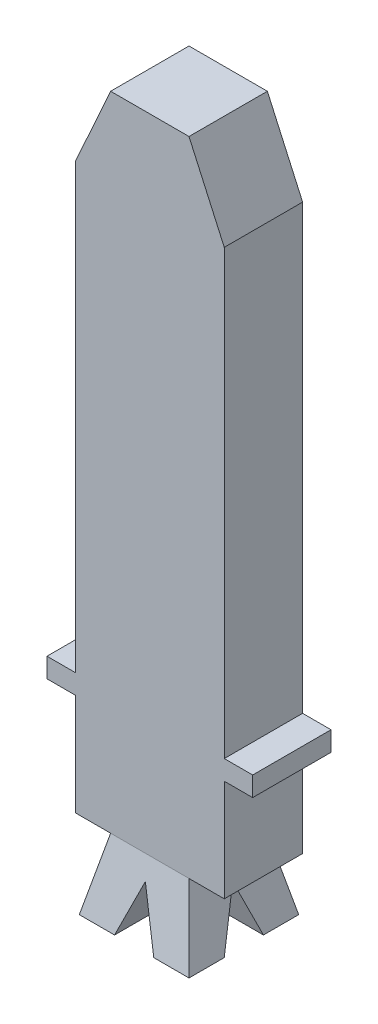
from build123d import *

# Parameters (mm, degrees)
BOSS_EXTRUDE1_DEPTH     = 2
CUT_EXTRUDE1_DEPTH      = 14.733922435
CUT_EXTRUDE1_DEPTH_BACK = 14.733922435
CUT_EXTRUDE2_DEPTH      = 15.632519463
CUT_EXTRUDE2_DEPTH_BACK = 15.632519463


with BuildPart() as part:
    # Sketch1 → Boss-Extrude1 (new body)
    with BuildSketch(Plane.XY):
        Polygon((1.9, 0), (2.625, 0), (2.625, -0.5), (1.9, -0.5), (1.9, -3.1), (-1.9, -3.1), (-1.9, -0.5), (-2.625, -0.5), (-2.625, 0), (-1.9, 0), (-1.9, 11.3), (-1, 13.3), (1, 13.3), (1.9, 11.3), align=None)
    extrude(amount=BOSS_EXTRUDE1_DEPTH)


with BuildPart() as body_2:
    # Sketch2 → Loft1 section 0
    with BuildSketch(Plane.XZ.offset(3.1)):
        with BuildLine():
            Line((-1, 2), (1, 2))
            Line((1, 2), (1, 0))
            Line((1, 0), (-1, 0))
            Line((-1, 0), (-1, 2))
        make_face()
    # Sketch3 → Loft1 section 1
    with BuildSketch(Plane(origin=(0, -4.9, 0), x_dir=(-1, 0, 0), z_dir=(0, -1, 0))):
        with BuildLine():
            Line((-1.4, 0.4), (1.4, 0.4))
            Line((1.4, 0.4), (1.4, -2.4))
            Line((1.4, -2.4), (-1.4, -2.4))
            Line((-1.4, -2.4), (-1.4, 0.4))
        make_face()
    loft()

    # Sketch4 → Cut-Extrude1 (cut, two sides: drawn at the far end of the back side and taken through both)
    with BuildSketch(Plane.XY.offset(1.8).offset(-CUT_EXTRUDE1_DEPTH_BACK)):
        Polygon((0, -3.611513086), (-0.5, -4.9), (0.5, -4.9), align=None)
    extrude(amount=CUT_EXTRUDE1_DEPTH + CUT_EXTRUDE1_DEPTH_BACK, mode=Mode.SUBTRACT)

    # Sketch5 → Cut-Extrude2 (cut, two sides: drawn at the far end of the back side and taken through both)
    with BuildSketch(Plane(origin=(1.8, 0, -1.8), x_dir=(0, 0, 1), z_dir=(-1, 0, 0)).offset(-CUT_EXTRUDE2_DEPTH_BACK)):
        Polygon((2.8, -3.611513086), (2.3, -4.9), (3.3, -4.9), align=None)
    extrude(amount=CUT_EXTRUDE2_DEPTH + CUT_EXTRUDE2_DEPTH_BACK, mode=Mode.SUBTRACT)


solid = Compound([part.part, body_2.part])
